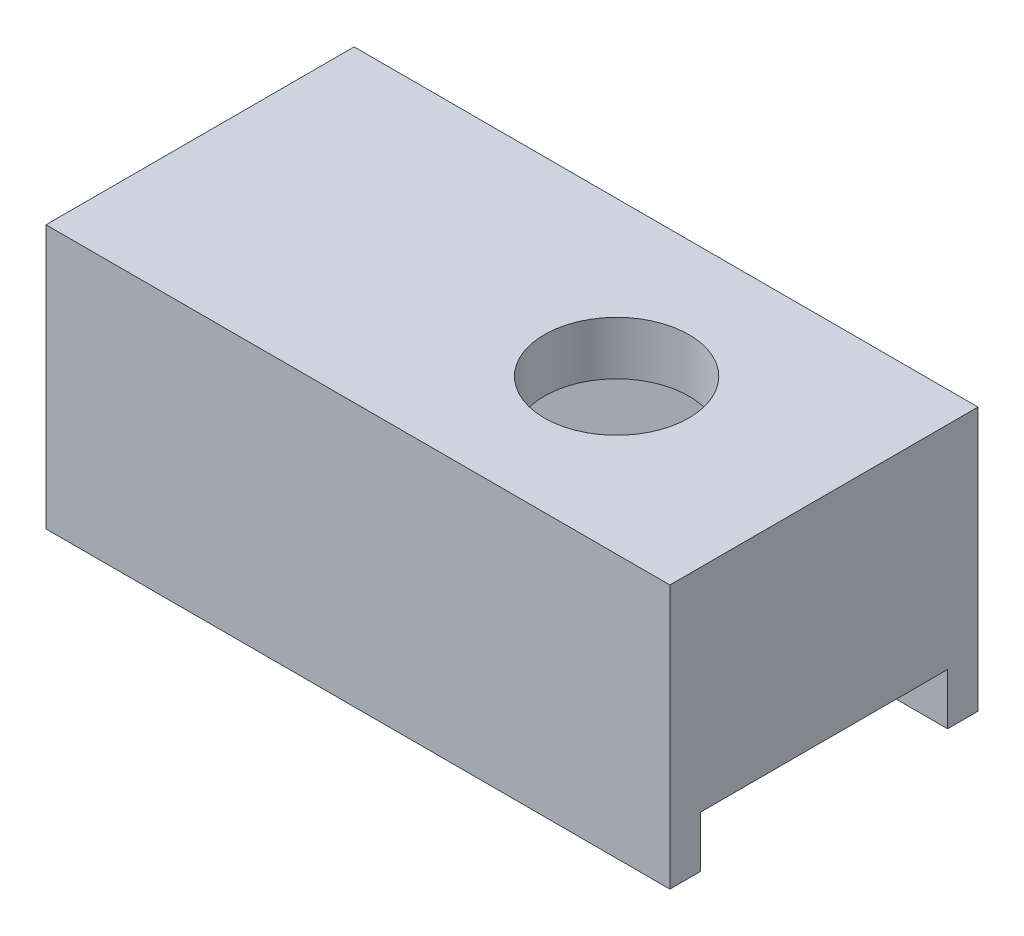
from build123d import *

# Parameters (mm, degrees)
BOSS_EXTRUDE1_START = 12.075
SKETCH1_W           = 32.8
SKETCH1_H           = 16.2
BOSS_EXTRUDE1_DEPTH = 6.925
CUT_EXTRUDE1_START  = 6.5
SKETCH2_W           = 32.8
SKETCH2_H           = 13
CUT_EXTRUDE1_DEPTH  = 1.35
CUT_EXTRUDE2_START  = 12.025
SKETCH3_W           = 23.4
SKETCH3_H           = 13
CUT_EXTRUDE2_DEPTH  = 4.175
CUT_EXTRUDE3_START  = 17.6
SKETCH4_R           = 3.8
CUT_EXTRUDE3_DEPTH  = 1.4
CUT_EXTRUDE4_START  = 11.84
SKETCH5_R           = 0.925
CUT_EXTRUDE4_DEPTH  = 4.01


with BuildPart() as part:
    # Sketch1 → Boss-Extrude1 (new, symmetric)
    with BuildSketch(Plane(origin=(0, 0, 0), x_dir=(1, 0, 0), z_dir=(0, 1, 0)).offset(BOSS_EXTRUDE1_START)):
        Rectangle(SKETCH1_W, SKETCH1_H)
    extrude(amount=BOSS_EXTRUDE1_DEPTH, both=True)

    # Sketch2 → Cut-Extrude1 (cut, symmetric)
    with BuildSketch(Plane(origin=(0, 0, 0), x_dir=(1, 0, 0), z_dir=(0, 1, 0)).offset(CUT_EXTRUDE1_START)):
        Rectangle(SKETCH2_W, SKETCH2_H)
    extrude(amount=CUT_EXTRUDE1_DEPTH, both=True, mode=Mode.SUBTRACT)

    # Sketch3 → Cut-Extrude2 (cut, symmetric)
    with BuildSketch(Plane(origin=(0, 0, 0), x_dir=(1, 0, 0), z_dir=(0, 1, 0)).offset(CUT_EXTRUDE2_START)):
        Rectangle(SKETCH3_W, SKETCH3_H)
    extrude(amount=CUT_EXTRUDE2_DEPTH, both=True, mode=Mode.SUBTRACT)

    # Sketch4 → Cut-Extrude3 (cut, symmetric)
    with BuildSketch(Plane(origin=(0, 0, 0), x_dir=(1, 0, 0), z_dir=(0, 1, 0)).offset(CUT_EXTRUDE3_START)):
        with Locations(Location((5.5, 0, 0), (0, 0, 270))):
            Circle(SKETCH4_R)
    extrude(amount=CUT_EXTRUDE3_DEPTH, both=True, mode=Mode.SUBTRACT)

    # Sketch5 → Cut-Extrude4 (cut, symmetric)
    with BuildSketch(Plane(origin=(0, 0, 0), x_dir=(1, 0, 0), z_dir=(0, 1, 0)).offset(CUT_EXTRUDE4_START)):
        with Locations(Location((-13.75, 0, 0), (0, 0, 270))):
            Circle(SKETCH5_R)
        with Locations(Location((13.75, 0, 0), (0, 0, 270))):
            Circle(SKETCH5_R)
    extrude(amount=CUT_EXTRUDE4_DEPTH, both=True, mode=Mode.SUBTRACT)


solid = part.part
